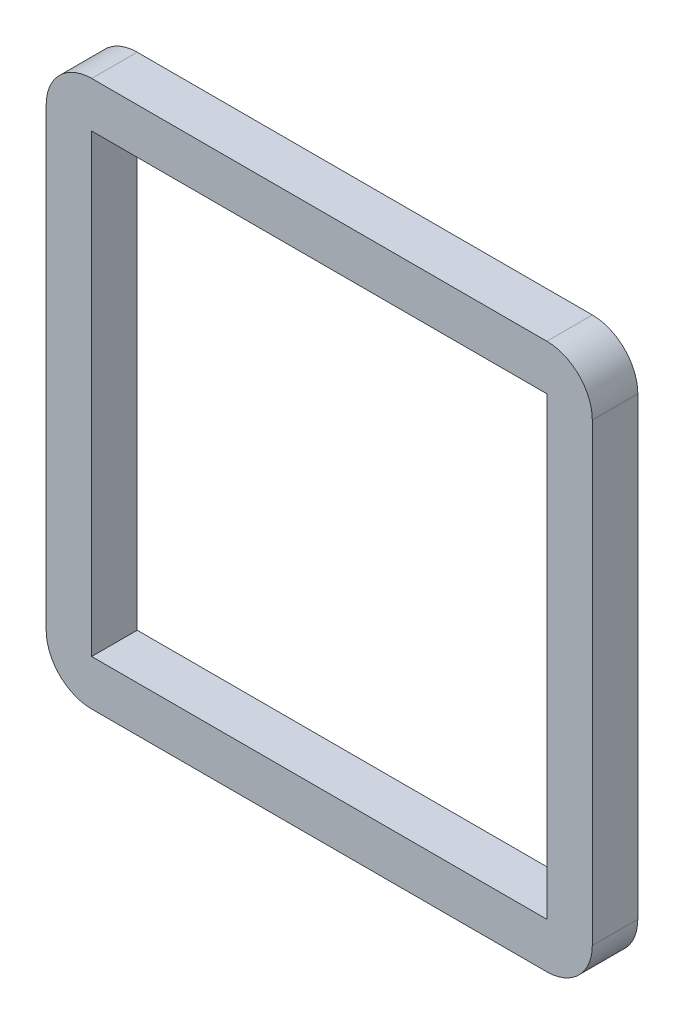
from build123d import *

# Parameters (mm, degrees)
BOSS_EXTRUDE1_DEPTH = 10
SKETCH3_W           = 100
SKETCH3_H           = 100
CUT_EXTRUDE1_DEPTH  = 10


with BuildPart() as part:
    # Sketch1 → Boss-Extrude1 (new body)
    with BuildSketch(Plane.XY):
        with BuildLine():
            Line((-50, 60), (50, 60))
            ThreePointArc((50, 60), (57.071067812, 57.071067812), (60, 50))
            Line((60, 50), (60, -50))
            ThreePointArc((60, -50), (57.071067812, -57.071067812), (50, -60))
            Line((50, -60), (-50, -60))
            ThreePointArc((-50, -60), (-57.071067812, -57.071067812), (-60, -50))
            Line((-60, -50), (-60, 50))
            ThreePointArc((-60, 50), (-57.071067812, 57.071067812), (-50, 60))
        make_face()
    extrude(amount=BOSS_EXTRUDE1_DEPTH)

    # Sketch3 → Cut-Extrude1 (cut)
    with BuildSketch(Plane.XY.offset(10)):
        Rectangle(SKETCH3_W, SKETCH3_H)
    extrude(amount=-CUT_EXTRUDE1_DEPTH, mode=Mode.SUBTRACT)


solid = part.part
